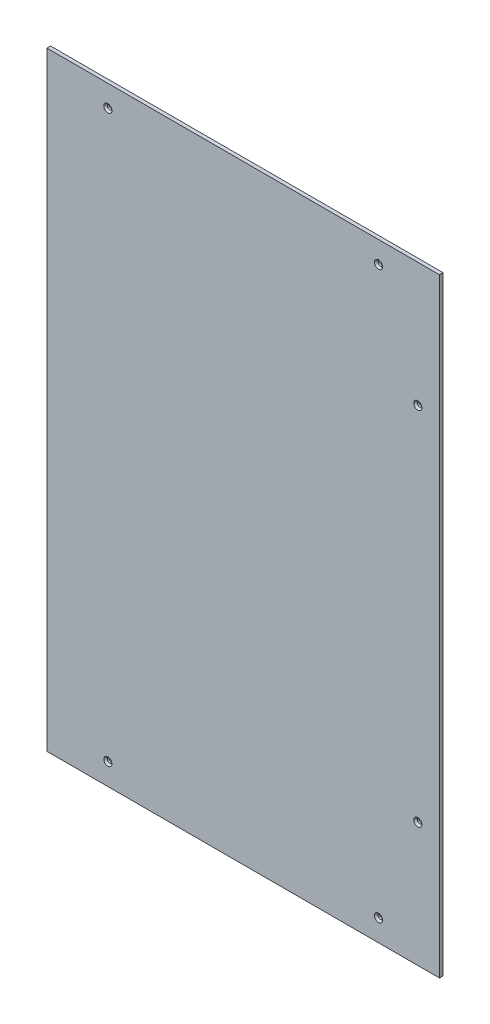
from build123d import *

# Parameters (mm, degrees)
ESQUISSE1_W             = 435
ESQUISSE1_H             = 675
BOSS_EXTRU_1_DEPTH      = 2
ESQUISSE3_R             = 2.5
ENL_V_MAT_EXTRU_1_DEPTH = 402.532688582
CHANFREIN1_SIZE         = 2


with BuildPart() as part:
    # Esquisse1 → Boss.-Extru.1 (new, symmetric)
    with BuildSketch(Plane.XY):
        Rectangle(ESQUISSE1_W, ESQUISSE1_H)
    extrude(amount=BOSS_EXTRU_1_DEPTH, both=True)

    # Esquisse3 → Enlèv. mat.-Extru.1 (cut, through all)
    with BuildSketch(Plane.XY.offset(2)):
        with Locations((-150, -313.5)):
            Circle(ESQUISSE3_R)
        with Locations((150, -313.5)):
            Circle(ESQUISSE3_R)
        with Locations((193.5, -200)):
            Circle(ESQUISSE3_R)
        with Locations((193.5, 200)):
            Circle(ESQUISSE3_R)
        with Locations((150, 313.5)):
            Circle(ESQUISSE3_R)
        with Locations((-150, 313.5)):
            Circle(ESQUISSE3_R)
    extrude(amount=-ENL_V_MAT_EXTRU_1_DEPTH, mode=Mode.SUBTRACT)

    # Chanfrein1
    chanfrein1_edges = [part.edges().sort_by_distance(p)[0] for p in [
        (-152.5, 313.5, 2),
        (147.5, 313.5, 2),
        (191, 200, 2),
        (191, -200, 2),
        (147.5, -313.5, 2),
        (-152.5, -313.5, 2),
    ]]
    chamfer(chanfrein1_edges, length=CHANFREIN1_SIZE)


solid = part.part
